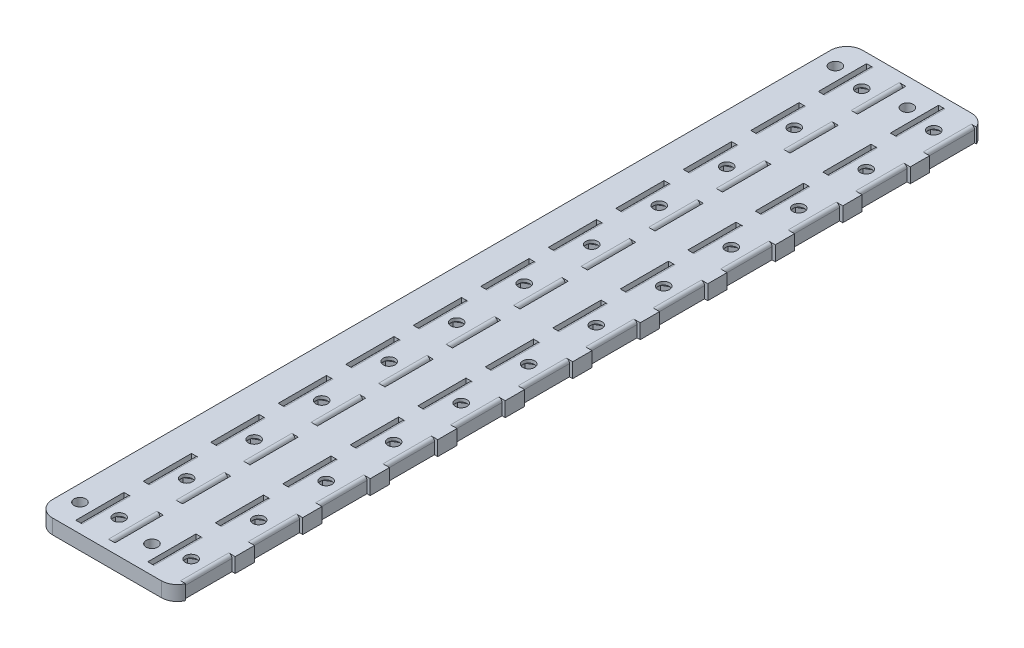
from build123d import *

# Parameters (mm, degrees)
SKETCH1_W              = 43.8
SKETCH1_H              = 252
BOSS_EXTRUDE1_DEPTH    = 3.571875
SKETCH2_R              = 3.175
CUT_EXTRUDE1_DEPTH     = 0.762
CUT_EXTRUDE2_DEPTH     = 128.919917908
SKETCH4_W              = 43.8
SKETCH4_H              = 252
BOSS_EXTRUDE2_DEPTH    = 1
SKETCH5_R              = 1.8288
CUT_EXTRUDE3_DEPTH     = 1
LPATTERN1_COUNT        = 12
LPATTERN1_PITCH        = 21
LPATTERN1_COUNT_DIR2   = 2
LPATTERN1_PITCH_DIR2   = 22.4
FILLET1_R              = 5
SKETCH7_W              = 1
SKETCH7_H              = 15
CUT_EXTRUDE4_DEPTH     = 128.970746817
FILLET5_R              = 1
LPATTERN2_COUNT        = 12
LPATTERN2_PITCH        = 21
LPATTERN2_COUNT_DIR2   = 2
LPATTERN2_PITCH_DIR2   = 22.4
FILLET5_OF_LPATTERN2_R = 1
F_6_CLEARANCE_HOLE1_D  = 3.6576
LPATTERN5_COUNT        = 2
LPATTERN5_PITCH        = 22.4
MIRROR1_COPY_1_D       = 3.6576


with BuildPart() as part:
    # Sketch1 → Boss-Extrude1 (new body)
    with BuildSketch(Plane(origin=(0, 0, 0), x_dir=(1, 0, 0), z_dir=(0, 1, 0))):
        Rectangle(SKETCH1_W, SKETCH1_H)
    extrude(amount=BOSS_EXTRUDE1_DEPTH)

    # Sketch2 → Cut-Extrude1 (cut)
    with BuildSketch(Plane(origin=(0, 3.571875, 0), x_dir=(1, 0, 0), z_dir=(0, 1, 0))):
        with Locations(Location((15.7, -115.5, 0), (0, 0, 270))):
            Circle(SKETCH2_R)
    cut_extrude1 = extrude(amount=-CUT_EXTRUDE1_DEPTH, mode=Mode.SUBTRACT)

    # Sketch3 → Cut-Extrude2 (cut, through all)
    with BuildSketch(Plane(origin=(0, 2.809875, 0), x_dir=(1, 0, 0), z_dir=(0, 1, 0))):
        Polygon((13.16, -114.033530316), (13.16, -116.966469684), (15.7, -118.432939367), (18.24, -116.966469684), (18.24, -114.033530316), (15.7, -112.567060633), align=None)
    cut_extrude2 = extrude(amount=-CUT_EXTRUDE2_DEPTH, mode=Mode.SUBTRACT)

    # Sketch4 → Boss-Extrude2 (add)
    with BuildSketch(Plane(origin=(0, 3.571875, 0), x_dir=(1, 0, 0), z_dir=(0, 1, 0))):
        Rectangle(SKETCH4_W, SKETCH4_H)
    extrude(amount=BOSS_EXTRUDE2_DEPTH)

    # Sketch5 → Cut-Extrude3 (cut)
    with BuildSketch(Plane(origin=(0, 4.571875, 0), x_dir=(1, 0, 0), z_dir=(0, 1, 0))):
        with Locations(Location((15.7, -115.5, 0), (0, 0, 270))):
            Circle(SKETCH5_R)
    cut_extrude3 = extrude(amount=-CUT_EXTRUDE3_DEPTH, mode=Mode.SUBTRACT)

    # LPattern1: Cut-Extrude1, Cut-Extrude2, Cut-Extrude3 12 × 2
    with Locations(*[(-j * LPATTERN1_PITCH_DIR2, 0, -i * LPATTERN1_PITCH) for i in range(LPATTERN1_COUNT) for j in range(LPATTERN1_COUNT_DIR2) if (i, j) != (0, 0)]):
        add(cut_extrude1, mode=Mode.SUBTRACT)
        add(cut_extrude2, mode=Mode.SUBTRACT)
        add(cut_extrude3, mode=Mode.SUBTRACT)

    # Fillet1
    fillet1_edges = [part.edges().sort_by_distance(p)[0] for p in [
        (-21.9, 2.2859375, -126),
        (21.9, 2.2859375, -126),
        (21.9, 2.2859375, 126),
        (-21.9, 2.2859375, 126),
    ]]
    fillet(fillet1_edges, radius=FILLET1_R)

    # Sketch7 → Cut-Extrude4 (cut, through all)
    with BuildSketch(Plane(origin=(0, 4.571875, 0), x_dir=(1, 0, 0), z_dir=(0, 1, 0))):
        with Locations((-1, -115.5)):
            Rectangle(SKETCH7_W, SKETCH7_H)
        with Locations((-12.2, -115.5)):
            Rectangle(SKETCH7_W, SKETCH7_H)
    cut_extrude4 = extrude(amount=-CUT_EXTRUDE4_DEPTH, mode=Mode.SUBTRACT)

    # Fillet5
    fillet5_edges = [part.edges().sort_by_distance(p)[0] for p in [
        (-1.5, 4.571875, 115.5),
        (-11.7, 4.571875, 115.5),
    ]]
    fillet(fillet5_edges, radius=FILLET5_R)

    # LPattern2: Cut-Extrude4 12 × 2
    with Locations(*[(j * LPATTERN2_PITCH_DIR2, 0, -i * LPATTERN2_PITCH) for i in range(LPATTERN2_COUNT) for j in range(LPATTERN2_COUNT_DIR2) if (i, j) != (0, 0)]):
        add(cut_extrude4, mode=Mode.SUBTRACT)

    # Fillet5 of LPattern2
    fillet5_of_lpattern2_edges = [part.edges().sort_by_distance(p)[0] for p in [
        (20.9, 4.571875, 115.5),
        (10.7, 4.571875, 115.5),
        (-1.5, 4.571875, 94.5),
        (-11.7, 4.571875, 94.5),
        (20.9, 4.571875, 94.5),
        (10.7, 4.571875, 94.5),
        (-1.5, 4.571875, 73.5),
        (-11.7, 4.571875, 73.5),
        (20.9, 4.571875, 73.5),
        (10.7, 4.571875, 73.5),
        (-1.5, 4.571875, 52.5),
        (-11.7, 4.571875, 52.5),
        (20.9, 4.571875, 52.5),
        (10.7, 4.571875, 52.5),
        (-1.5, 4.571875, 31.5),
        (-11.7, 4.571875, 31.5),
        (20.9, 4.571875, 31.5),
        (10.7, 4.571875, 31.5),
        (-1.5, 4.571875, 10.5),
        (-11.7, 4.571875, 10.5),
        (20.9, 4.571875, 10.5),
        (10.7, 4.571875, 10.5),
        (-1.5, 4.571875, -10.5),
        (-11.7, 4.571875, -10.5),
        (20.9, 4.571875, -10.5),
        (10.7, 4.571875, -10.5),
        (-1.5, 4.571875, -31.5),
        (-11.7, 4.571875, -31.5),
        (20.9, 4.571875, -31.5),
        (10.7, 4.571875, -31.5),
        (-1.5, 4.571875, -52.5),
        (-11.7, 4.571875, -52.5),
        (20.9, 4.571875, -52.5),
        (10.7, 4.571875, -52.5),
        (-1.5, 4.571875, -73.5),
        (-11.7, 4.571875, -73.5),
        (20.9, 4.571875, -73.5),
        (10.7, 4.571875, -73.5),
        (-1.5, 4.571875, -94.5),
        (-11.7, 4.571875, -94.5),
        (20.9, 4.571875, -94.5),
        (10.7, 4.571875, -94.5),
        (-1.5, 4.571875, -115.5),
        (-11.7, 4.571875, -115.5),
        (20.9, 4.571875, -115.5),
        (10.7, 4.571875, -115.5),
    ]]
    fillet(fillet5_of_lpattern2_edges, radius=FILLET5_OF_LPATTERN2_R)

    # #6 Clearance Hole1 (through all)
    with Locations(Plane(origin=(0, 4.571875, 0), x_dir=(1, 0, 0), z_dir=(0, 1, 0))):
        with Locations((5.5, 117.5)):
            f_6_clearance_hole1 = Hole(F_6_CLEARANCE_HOLE1_D / 2)

    # LPattern5: #6 Clearance Hole1 ×2
    with Locations(*[(-i * LPATTERN5_PITCH, 0, 0) for i in range(1, LPATTERN5_COUNT)]):
        add(f_6_clearance_hole1, mode=Mode.SUBTRACT)

    # Mirror1: #6 Clearance Hole1 across plane
    add(f_6_clearance_hole1.mirror(Plane.XY), mode=Mode.SUBTRACT)

    # Mirror1 copy 1 (through all)
    with Locations(Plane(origin=(-22.4, 4.571875, 0), x_dir=(1, 0, 0), z_dir=(0, 1, 0))):
        with Locations((5.5, -117.5)):
            Hole(MIRROR1_COPY_1_D / 2)


solid = part.part
